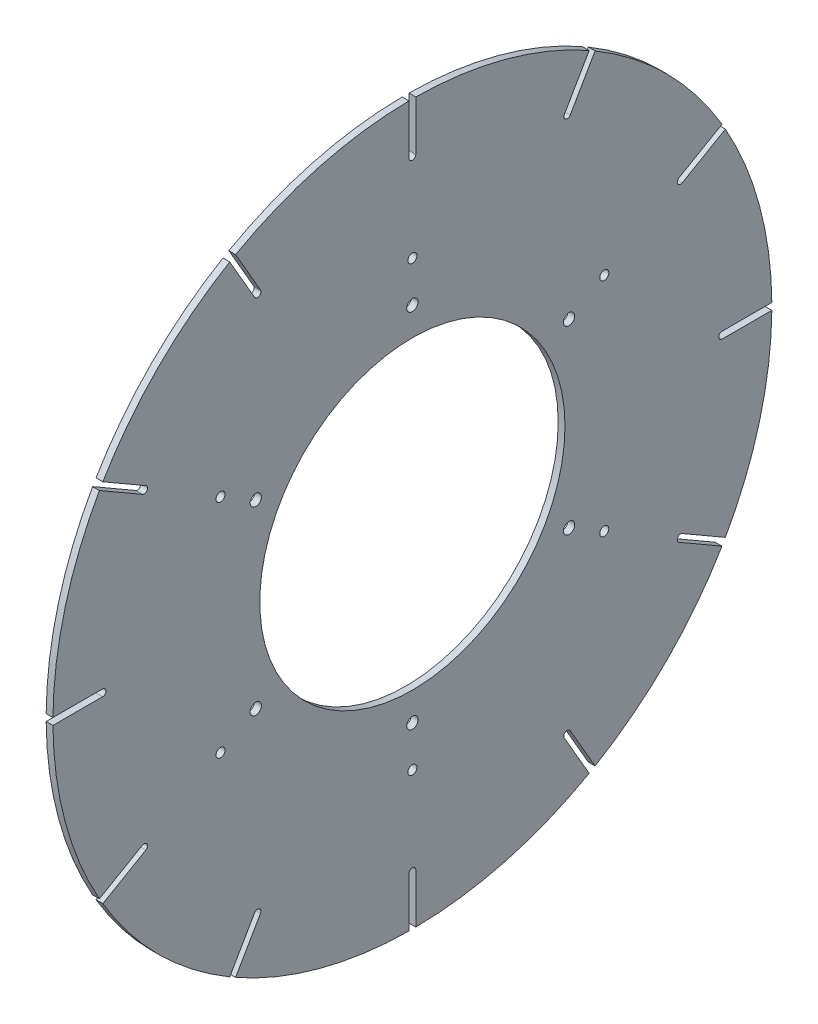
from build123d import *

# Parameters (mm, degrees)
SKETCH1_R           = 159
BOSS_EXTRUDE1_DEPTH = 3
SKETCH2_R           = 2
SKETCH2_R_2         = 1.5
SKETCH2_R_3         = 2.5
SKETCH2_R_4         = 67.5
CUT_EXTRUDE1_DEPTH  = 3
CUT_EXTRUDE2_DEPTH  = 225.879967983
CIRPATTERN1_COUNT   = 12


with BuildPart() as part:
    # Sketch1 → Boss-Extrude1 (new body)
    with BuildSketch(Plane(origin=(0, 0, 0), x_dir=(0, 0, -1), z_dir=(1, 0, 0))):
        Circle(SKETCH1_R)
    extrude(amount=BOSS_EXTRUDE1_DEPTH)

    # Sketch2 → Cut-Extrude1 (cut)
    with BuildSketch(Plane(origin=(3, 0, 0), x_dir=(0, 0, -1), z_dir=(1, 0, 0))):
        with Locations((0, -98)):
            Circle(SKETCH2_R)
        with Locations((-84.870489571, -49)):
            Circle(SKETCH2_R)
        with Locations((-84.870489571, 49)):
            Circle(SKETCH2_R)
        with Locations((0, 98)):
            Circle(SKETCH2_R)
        with Locations((84.870489571, 49)):
            Circle(SKETCH2_R)
        with Locations((84.870489571, -49)):
            Circle(SKETCH2_R)
        with Locations((0, -150)):
            Circle(SKETCH2_R_2)
        with Locations((-129.903810568, -75)):
            Circle(SKETCH2_R_2)
        with Locations((-129.903810568, 75)):
            Circle(SKETCH2_R_2)
        with Locations((0, 150)):
            Circle(SKETCH2_R_2)
        with Locations((129.903810568, 75)):
            Circle(SKETCH2_R_2)
        with Locations((129.903810568, -75)):
            Circle(SKETCH2_R_2)
        with Locations((0, -80)):
            Circle(SKETCH2_R_3)
        with Locations((-69.282032303, -40)):
            Circle(SKETCH2_R_3)
        with Locations((-69.282032303, 40)):
            Circle(SKETCH2_R_3)
        with Locations((0, 80)):
            Circle(SKETCH2_R_3)
        with Locations((69.282032303, 40)):
            Circle(SKETCH2_R_3)
        with Locations((69.282032303, -40)):
            Circle(SKETCH2_R_3)
        Circle(SKETCH2_R_4)
    extrude(amount=-CUT_EXTRUDE1_DEPTH, mode=Mode.SUBTRACT)

    # Sketch3 → Cut-Extrude2 (cut, through all)
    with BuildSketch(Plane(origin=(3, 0, 0), x_dir=(0, 0, -1), z_dir=(1, 0, 0))):
        with BuildLine():
            Line((117.895480318, 69.799038106), (148.709562393, 87.589556686))
            ThreePointArc((148.709562393, 87.589556686), (150.758600499, 87.040518581), (150.209562393, 84.991480475))
            Line((150.209562393, 84.991480475), (119.395480318, 67.200961894))
            ThreePointArc((119.395480318, 67.200961894), (117.346442213, 67.75), (117.895480318, 69.799038106))
        make_face()
    cut_extrude2 = extrude(amount=-CUT_EXTRUDE2_DEPTH, mode=Mode.SUBTRACT)

    # CirPattern1: Cut-Extrude2 ×12 about axis
    cirpattern1_axis = Axis((0, 0, 0), (1, 0, 0))
    for i in range(1, CIRPATTERN1_COUNT):
        add(cut_extrude2.rotate(cirpattern1_axis, i * 360 / CIRPATTERN1_COUNT), mode=Mode.SUBTRACT)


solid = part.part
